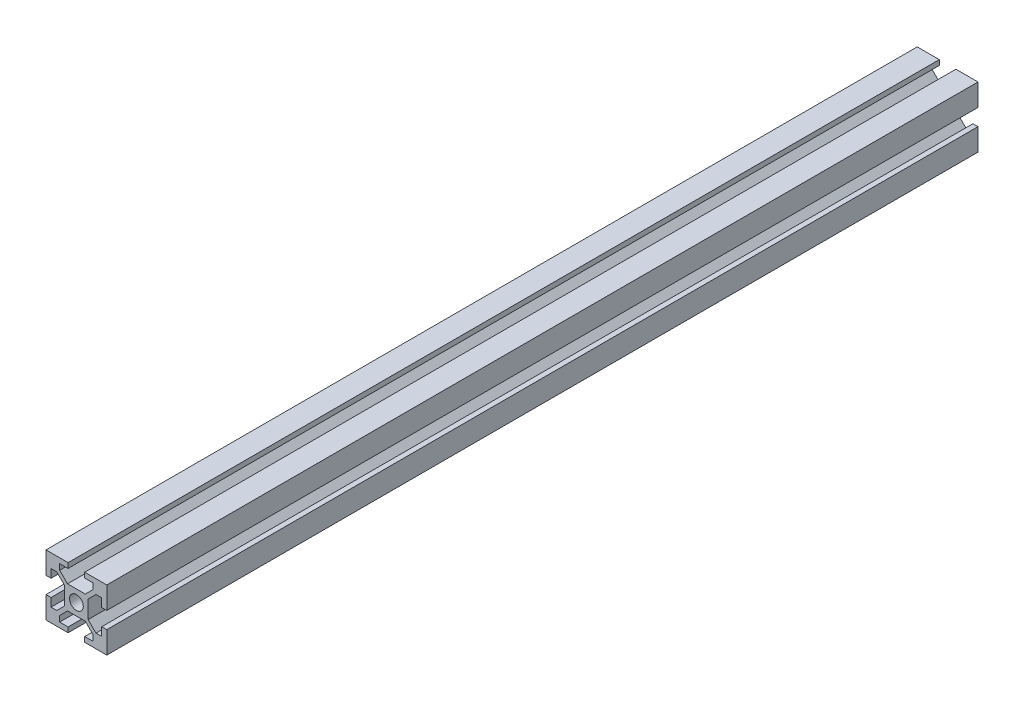
from build123d import *

# Parameters (mm, degrees)
SKETCH_1_R      = 3.4
EXTRUDE_1_DEPTH = 430


with BuildPart() as part:
    # 草图1 → 凸台-拉伸1 (new body)
    with BuildSketch(Plane.XY):
        Polygon((-4.1, 12.5), (-4.1, 15), (-8.25, 15), (-15, 15), (-15, 8.25), (-15, 4.1), (-12.5, 4.1), (-12.5, 8.25), (-9.664213562, 8.25), (-5.8, 4.385786438), (-5.8, -4.385786438), (-9.664213562, -8.25), (-12.5, -8.25), (-12.5, -4.1), (-15, -4.1), (-15, -8.25), (-15, -15), (-8.25, -15), (-4.1, -15), (-4.1, -12.5), (-8.25, -12.5), (-8.25, -9.664213562), (-4.385786438, -5.8), (4.385786438, -5.8), (8.25, -9.664213562), (8.25, -12.5), (4.1, -12.5), (4.1, -15), (8.25, -15), (15, -15), (15, -8.25), (15, -4.1), (12.5, -4.1), (12.5, -8.25), (9.664213562, -8.25), (5.8, -4.385786438), (5.8, 4.385786438), (9.664213562, 8.25), (12.5, 8.25), (12.5, 4.1), (15, 4.1), (15, 8.25), (15, 15), (8.25, 15), (4.1, 15), (4.1, 12.5), (8.25, 12.5), (8.25, 9.664213562), (4.385786438, 5.8), (-4.385786438, 5.8), (-8.25, 9.664213562), (-8.25, 12.5), align=None)
        Circle(SKETCH_1_R, mode=Mode.SUBTRACT)
    extrude(amount=EXTRUDE_1_DEPTH)


solid = part.part
